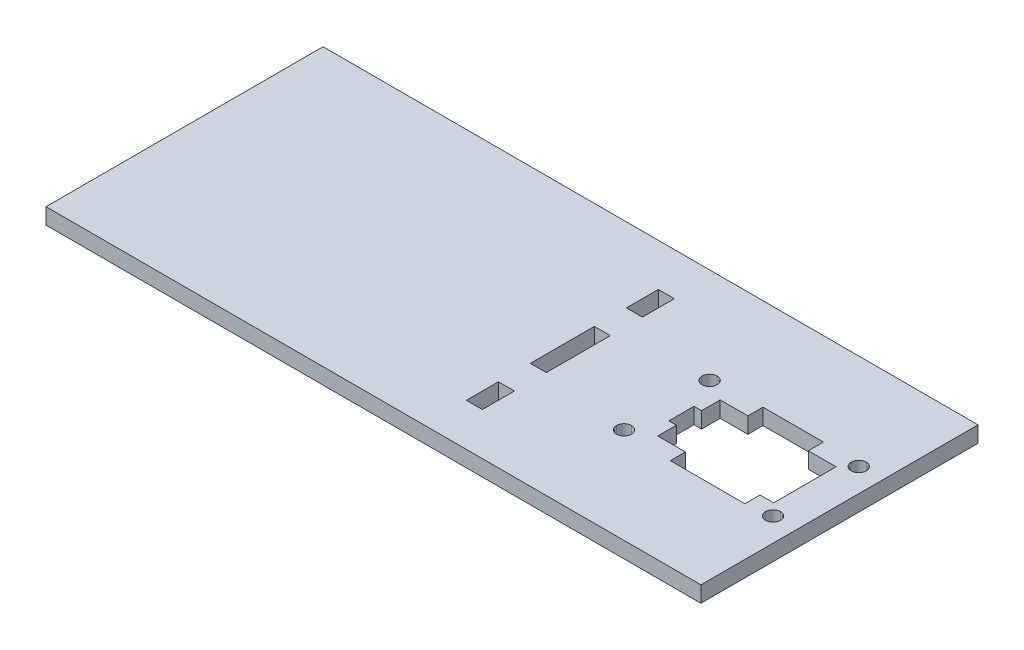
from build123d import *

# Parameters (mm, degrees)
SKETCH1_W           = 130
SKETCH1_H           = 55
SKETCH1_W_2         = 3.175
SKETCH1_H_2         = 6.35
SKETCH1_H_3         = 12.7
BOSS_EXTRUDE1_DEPTH = 3.175


with BuildPart() as part:
    # Sketch1 → Boss-Extrude1 (new body)
    with BuildSketch(Plane(origin=(0, 0, 0), x_dir=(1, 0, 0), z_dir=(0, 1, 0))):
        with Locations((65, 27.5)):
            Rectangle(SKETCH1_W, SKETCH1_H)
        with Locations((76.5875, 43.375)):
            Rectangle(SKETCH1_W_2, SKETCH1_H_2, mode=Mode.SUBTRACT)
        with Locations((76.5875, 11.625)):
            Rectangle(SKETCH1_W_2, SKETCH1_H_2, mode=Mode.SUBTRACT)
        with Locations((76.5875, 27.5)):
            Rectangle(SKETCH1_W_2, SKETCH1_H_3, mode=Mode.SUBTRACT)
        Polygon((98.622387284, 25), (100.122287284, 25), (100.122287284, 21.3), (105.622287284, 21.3), (105.622287284, 18.3002), (120.422287284, 18.3002), (120.422287284, 21.3), (123.122287284, 21.3), (123.122287284, 33.7), (117.622287284, 33.7), (117.622287284, 36.7), (105.622287284, 36.7), (105.622287284, 33.7), (100.122287284, 33.7), (100.122287284, 30), (98.622387284, 30), align=None, mode=Mode.SUBTRACT)
        with BuildLine():
            add(Edge.make_bspline(
                [(97.222287284, 36), (97.222287284, 35.1715), (96.550787284, 34.5), (95.722387284, 34.5)],
                knots=[0, 0, 0, 0, 0.2, 0.2, 0.2, 0.2], degree=3))
            add(Edge.make_bspline(
                [(95.722387284, 34.5), (94.893887284, 34.4999), (94.222387284, 35.1715), (94.222387284, 35.9999)],
                knots=[0.2, 0.2, 0.2, 0.2, 0.4, 0.4, 0.4, 0.4], degree=3))
            add(Edge.make_bspline(
                [(94.222387284, 35.9999), (94.222287284, 36.8284), (94.893887284, 37.4999), (95.722287284, 37.5)],
                knots=[0.4, 0.4, 0.4, 0.4, 0.6, 0.6, 0.6, 0.6], degree=3))
            add(Edge.make_bspline(
                [(95.722287284, 37.5), (96.550787284, 37.5), (97.222287284, 36.8284), (97.222287284, 36)],
                knots=[0.6, 0.6, 0.6, 0.6, 1, 1, 1, 1], degree=3))
        make_face(mode=Mode.SUBTRACT)
        with BuildLine():
            add(Edge.make_bspline(
                [(126.822287284, 19.0002), (126.822287284, 18.1718), (126.150687284, 17.5002), (125.322387284, 17.5002)],
                knots=[0, 0, 0, 0, 0.2, 0.2, 0.2, 0.2], degree=3))
            add(Edge.make_bspline(
                [(125.322387284, 17.5002), (124.493987284, 17.5002), (123.822387284, 18.1718), (123.822387284, 19.0001)],
                knots=[0.2, 0.2, 0.2, 0.2, 0.4, 0.4, 0.4, 0.4], degree=3))
            add(Edge.make_bspline(
                [(123.822387284, 19.0001), (123.822387284, 19.8285), (124.493987284, 20.4999), (125.322287284, 20.4999)],
                knots=[0.4, 0.4, 0.4, 0.4, 0.6, 0.6, 0.6, 0.6], degree=3))
            add(Edge.make_bspline(
                [(125.322287284, 20.4999), (126.150687284, 20.4999), (126.822287284, 19.8285), (126.822287284, 19.0002)],
                knots=[0.6, 0.6, 0.6, 0.6, 1, 1, 1, 1], degree=3))
        make_face(mode=Mode.SUBTRACT)
        with BuildLine():
            add(Edge.make_bspline(
                [(97.222287284, 19.0002), (97.222287284, 18.1718), (96.550687284, 17.5001), (95.722387284, 17.5001)],
                knots=[0, 0, 0, 0, 0.2, 0.2, 0.2, 0.2], degree=3))
            add(Edge.make_bspline(
                [(95.722387284, 17.5001), (94.893987284, 17.5001), (94.222287284, 18.1718), (94.222287284, 19.0001)],
                knots=[0.2, 0.2, 0.2, 0.2, 0.4, 0.4, 0.4, 0.4], degree=3))
            add(Edge.make_bspline(
                [(94.222287284, 19.0001), (94.222287284, 19.8285), (94.893987284, 20.5), (95.722287284, 20.5)],
                knots=[0.4, 0.4, 0.4, 0.4, 0.6, 0.6, 0.6, 0.6], degree=3))
            add(Edge.make_bspline(
                [(95.722287284, 20.5), (96.550687284, 20.5), (97.222287284, 19.8285), (97.222287284, 19.0002)],
                knots=[0.6, 0.6, 0.6, 0.6, 1, 1, 1, 1], degree=3))
        make_face(mode=Mode.SUBTRACT)
        with BuildLine():
            add(Edge.make_bspline(
                [(126.822287284, 36), (126.822287284, 35.1715), (126.150787284, 34.5001), (125.322387284, 34.5001)],
                knots=[0, 0, 0, 0, 0.2, 0.2, 0.2, 0.2], degree=3))
            add(Edge.make_bspline(
                [(125.322387284, 34.5001), (124.493887284, 34.5), (123.822487284, 35.1715), (123.822487284, 35.9999)],
                knots=[0.2, 0.2, 0.2, 0.2, 0.4, 0.4, 0.4, 0.4], degree=3))
            add(Edge.make_bspline(
                [(123.822487284, 35.9999), (123.822387284, 36.8284), (124.493887284, 37.4998), (125.322287284, 37.4999)],
                knots=[0.4, 0.4, 0.4, 0.4, 0.6, 0.6, 0.6, 0.6], degree=3))
            add(Edge.make_bspline(
                [(125.322287284, 37.4999), (126.150787284, 37.4999), (126.822287284, 36.8284), (126.822287284, 36)],
                knots=[0.6, 0.6, 0.6, 0.6, 1, 1, 1, 1], degree=3))
        make_face(mode=Mode.SUBTRACT)
    extrude(amount=BOSS_EXTRUDE1_DEPTH)


solid = part.part
